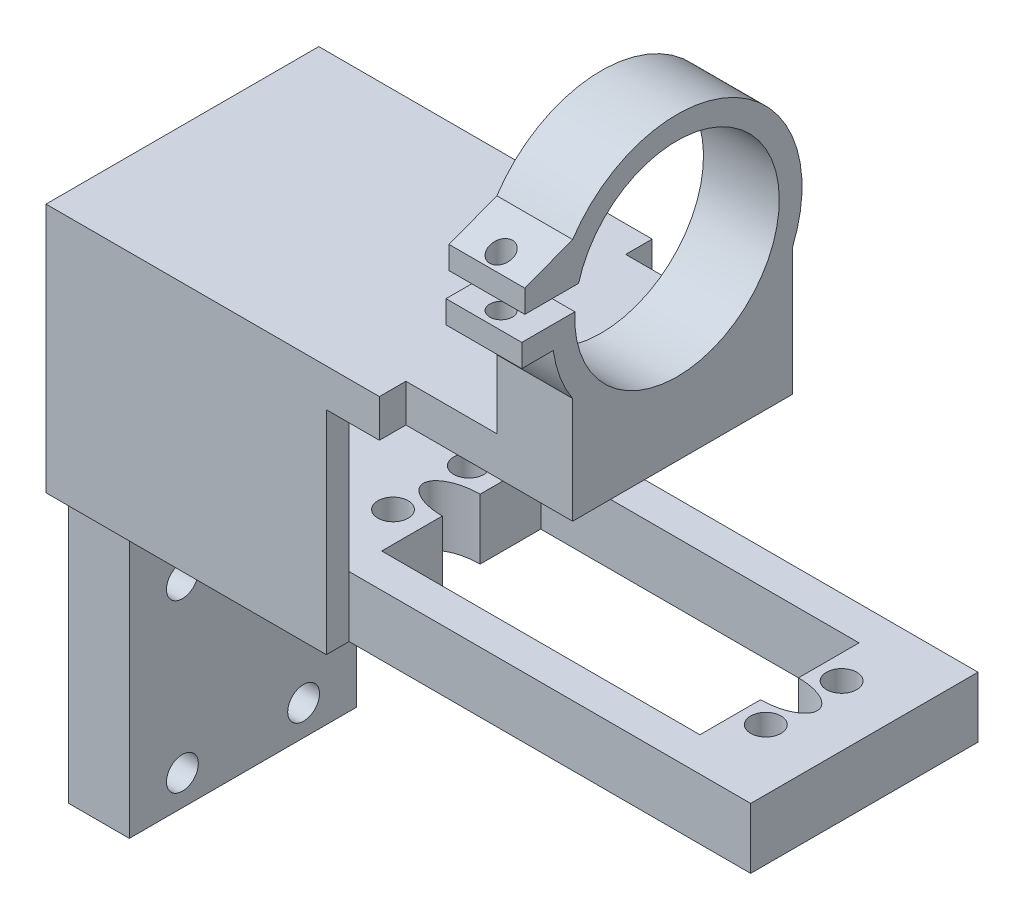
from build123d import *

# Parameters (mm, degrees)
SKETCH_1_W          = 82
SKETCH_1_H          = 30
EXTRUDE_1_DEPTH     = 8
SKETCH_2_R          = 2
CUT_EXTRUDE_1_DEPTH = 8
SKETCH_4_W          = 8
SKETCH_4_H          = 30
EXTRUDE_2_DEPTH     = 45
EXTRUDE_5_DEPTH     = 30
SKETCH_15_R         = 2.1
CUT_EXTRUDE_2_DEPTH = 10
SKETCH_17_W         = 37
SKETCH_17_H         = 3
EXTRUDE_6_DEPTH     = 20
EXTRUDE_6_2_DEPTH   = 20
SKETCH_18_W         = 66
SKETCH_18_H         = 36
EXTRUDE_7_DEPTH     = 5
SKETCH_19_W         = 37
SKETCH_19_H         = 3
EXTRUDE_8_DEPTH     = 8
SKETCH_20_W         = 22
SKETCH_20_H         = 3.5
CUT_EXTRUDE_3_DEPTH = 5
SKETCH_21_R         = 16.5
SKETCH_21_R_2       = 13.5
EXTRUDE_9_DEPTH     = 10
SKETCH_22_W         = 9.765091575
SKETCH_22_H         = 3
CUT_EXTRUDE_4_DEPTH = 10
EXTRUDE_10_DEPTH    = 10
SKETCH_24_R         = 1.5
CUT_EXTRUDE_5_DEPTH = 15


with BuildPart() as part:
    # 草圖1 → 填料-伸長1 (new body)
    with BuildSketch(Plane(origin=(0, 0, 0), x_dir=(1, 0, 0), z_dir=(0, 1, 0))):
        with Locations((41, 15)):
            Rectangle(SKETCH_1_W, SKETCH_1_H)
    extrude(amount=EXTRUDE_1_DEPTH)

    # 草圖2 → 除料-伸長1 (cut)
    with BuildSketch(Plane(origin=(0, 8, 0), x_dir=(1, 0, 0), z_dir=(0, 1, 0))):
        with Locations(Location((74, 20, 0), (0, 0, 270))):
            Circle(SKETCH_2_R)
        with Locations(Location((74, 10, 0), (0, 0, 270))):
            Circle(SKETCH_2_R)
        with Locations(Location((24.8, 20, 0), (0, 0, 270))):
            Circle(SKETCH_2_R)
        with Locations(Location((24.8, 10, 0), (0, 0, 270))):
            Circle(SKETCH_2_R)
        with BuildLine():
            Line((28.8, 25.5), (70.8, 25.5))
            Line((70.8, 25.5), (70.8, 17.5))
            add(Edge.make_bspline(
                [(70.8, 12.5), (75.8, 12.5), (75.8, 15), (75.8, 17.5), (70.8, 17.5)],
                knots=[4.71238898, 4.71238898, 4.71238898, 6.283185307, 6.283185307, 7.853981634, 7.853981634, 7.853981634], degree=2, weights=[1, 0.707106781, 1, 0.707106781, 1]))
            Line((70.8, 12.5), (70.8, 4.5))
            Line((70.8, 4.5), (28.8, 4.5))
            Line((28.8, 4.5), (28.8, 12.5))
            add(Edge.make_bspline(
                [(28.8, 17.5), (23.8, 17.5), (23.8, 15), (23.8, 12.5), (28.8, 12.5)],
                knots=[1.570796327, 1.570796327, 1.570796327, 3.141592654, 3.141592654, 4.71238898, 4.71238898, 4.71238898], degree=2, weights=[1, 0.707106781, 1, 0.707106781, 1]))
            Line((28.8, 17.5), (28.8, 25.5))
        make_face()
    extrude(amount=-CUT_EXTRUDE_1_DEPTH, mode=Mode.SUBTRACT)

    # 草圖4 → 填料-伸長2 (add)
    with BuildSketch(Plane(origin=(0, 8, 0), x_dir=(1, 0, 0), z_dir=(0, 1, 0))):
        with Locations((-4, 15)):
            Rectangle(SKETCH_4_W, SKETCH_4_H)
    extrude(amount=-EXTRUDE_2_DEPTH)

    # 草圖14 → 填料-伸長5 (add)
    with BuildSketch(Plane.XY):
        Polygon((0, 0), (0, -2), (2, 0), align=None)
    extrude(amount=-EXTRUDE_5_DEPTH)

    # 草圖15 → 除料-伸長2 (cut)
    with BuildSketch(Plane(origin=(0, 0, 0), x_dir=(0, 0, -1), z_dir=(1, 0, 0))):
        with Locations((7, -33)):
            Circle(SKETCH_15_R)
        with Locations((7, -11)):
            Circle(SKETCH_15_R)
        with Locations((23, -11)):
            Circle(SKETCH_15_R)
        with Locations((23, -33)):
            Circle(SKETCH_15_R)
    extrude(amount=-CUT_EXTRUDE_2_DEPTH, mode=Mode.SUBTRACT)



with BuildPart() as body_2:
    # 草圖17 → 填料-伸長6 (new body)
    with BuildSketch(Plane(origin=(0, 8, 0), x_dir=(1, 0, 0), z_dir=(0, 1, 0))):
        with Locations((10.5, -1.5)):
            Rectangle(SKETCH_17_W, SKETCH_17_H)
    extrude(amount=EXTRUDE_6_DEPTH)



with BuildPart() as body_3:
    # 草圖17 → Extrude 6 2 (new body)
    with BuildSketch(Plane(origin=(0, 8, 0), x_dir=(1, 0, 0), z_dir=(0, 1, 0))):
        with Locations((10.5, 31.5)):
            Rectangle(SKETCH_17_W, SKETCH_17_H)
    extrude(amount=EXTRUDE_6_2_DEPTH)


with BuildPart() as body_2_1:
    add(body_2.part)

    add(body_3.part)  # 填料-伸長7 merges body 3
    # 草圖18 → 填料-伸長7 (add)
    with BuildSketch(Plane(origin=(0, 28, 0), x_dir=(1, 0, 0), z_dir=(0, 1, 0))):
        with Locations((25, 15)):
            Rectangle(SKETCH_18_W, SKETCH_18_H)
    extrude(amount=EXTRUDE_7_DEPTH)


with BuildPart() as part_1:
    add(part.part)

    add(body_2_1.part)  # 填料-伸長8 merges body 2
    # 草圖19 → 填料-伸長8 (add)
    with BuildSketch(Plane(origin=(0, 8, 0), x_dir=(-1, 0, 0), z_dir=(0, -1, 0))):
        with Locations((-10.5, -1.5)):
            Rectangle(SKETCH_19_W, SKETCH_19_H)
        with Locations((-10.5, 31.5)):
            Rectangle(SKETCH_19_W, SKETCH_19_H)
    extrude(amount=EXTRUDE_8_DEPTH)

    # 草圖20 → 除料-伸長3 (cut)
    with BuildSketch(Plane(origin=(0, 33, 0), x_dir=(1, 0, 0), z_dir=(0, 1, 0))):
        with Locations((47, 31.25)):
            Rectangle(SKETCH_20_W, SKETCH_20_H)
        with Locations((47, -1.25)):
            Rectangle(SKETCH_20_W, SKETCH_20_H)
    extrude(amount=-CUT_EXTRUDE_3_DEPTH, mode=Mode.SUBTRACT)



with BuildPart() as body_2_2:
    # 草圖21 → 填料-伸長9 (new body)
    with BuildSketch(Plane(origin=(58, 0, 0), x_dir=(0, 0, -1), z_dir=(1, 0, 0))):
        with Locations((14.274721253, 51.113330164)):
            Circle(SKETCH_21_R)
        with Locations((14.274721253, 51.113330164)):
            Circle(SKETCH_21_R_2, mode=Mode.SUBTRACT)
    extrude(amount=-EXTRUDE_9_DEPTH)

    # 草圖22 → 除料-伸長4 (cut)
    with BuildSketch(Plane(origin=(58, 0, 0), x_dir=(0, 0, -1), z_dir=(1, 0, 0))):
        with Locations((-2.130977474, 53.296710416)):
            Rectangle(SKETCH_22_W, SKETCH_22_H)
    extrude(amount=-CUT_EXTRUDE_4_DEPTH, mode=Mode.SUBTRACT)


with BuildPart() as part_2:
    add(part_1.part)

    add(body_2_2.part)  # 填料-伸長10 merges body 2 2
    # 草圖23 → 填料-伸長10 (add)
    with BuildSketch(Plane(origin=(58, 0, 0), x_dir=(0, 0, -1), z_dir=(1, 0, 0))):
        Polygon((-1.808894943, 54.796710416), (-5.808894943, 54.796710416), (-5.808894943, 57.796710416), (0.5, 60.19666955), align=None)
        Polygon((-2.211120899, 51.796710416), (-6.211120899, 51.796710416), (-6.211120899, 48.796710416), (-2.061841205, 48.796710416), align=None)
        Polygon((0.5, 42.029990777), (0.5, 33), (29.5, 33), (29.5, 44.75401518), (27.62078064, 41.411129443), (13.64058676, 34.62552032), align=None)
    extrude(amount=-EXTRUDE_10_DEPTH)

    # 草圖24 → 除料-伸長5 (cut)
    with BuildSketch(Plane(origin=(0, 48.796710416, 0), x_dir=(-1, 0, 0), z_dir=(0, -1, 0))):
        with Locations(Location((-53, -3.931120899, 0), (0, 0, 90))):
            Circle(SKETCH_24_R)
    extrude(amount=-CUT_EXTRUDE_5_DEPTH, mode=Mode.SUBTRACT)


solid = part_2.part
